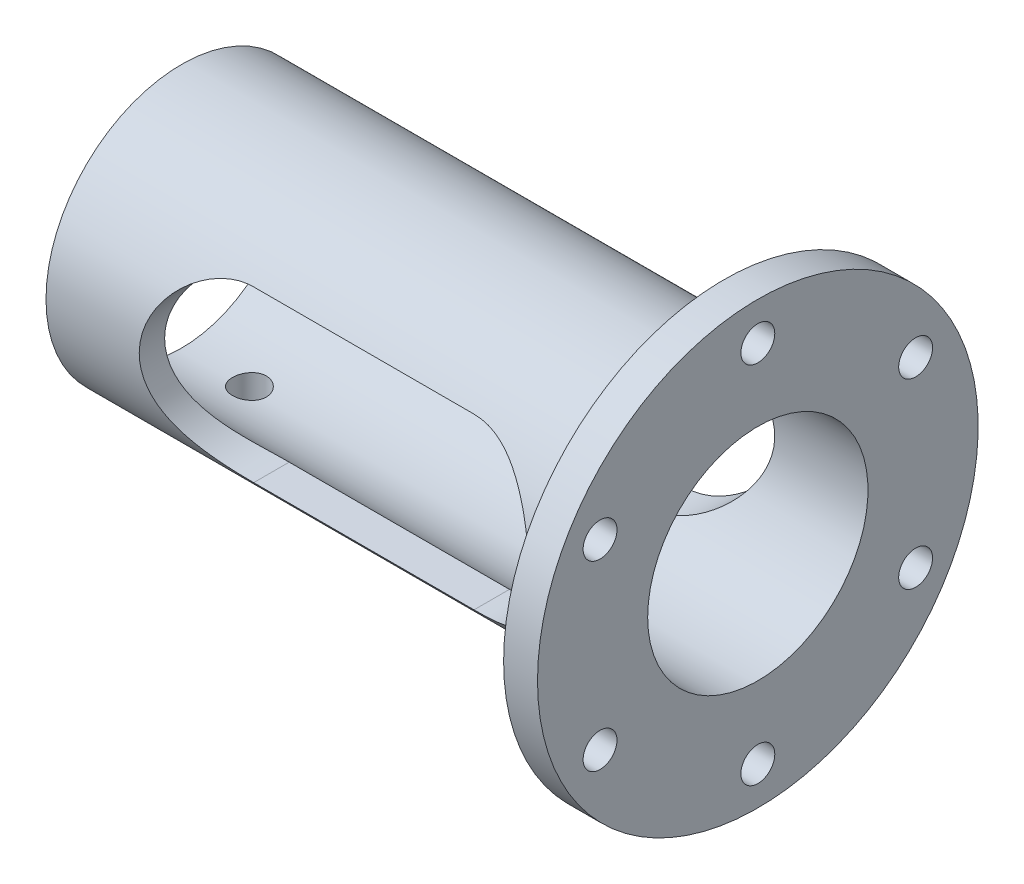
from build123d import *

# Parameters (mm, degrees)
SKETCH2_R               = 2
CUT_EXTRUDE1_DEPTH      = 78.30459236
CUT_EXTRUDE2_DEPTH      = 51.079936102
CUT_EXTRUDE2_DEPTH_BACK = 51.079936102
CUT_EXTRUDE3_DEPTH      = 1
CUT_EXTRUDE3_DEPTH_BACK = 51.07993617
SKETCH5_R               = 2


with BuildPart() as part:
    # Sketch1 → Revolve1 (revolve)
    with BuildSketch(Plane.XY, mode=Mode.PRIVATE) as revolve1_sk:
        Polygon((-34, 13), (-34, 16), (30, 16), (30, 26), (34, 26), (34, 13), align=None)
    revolve(revolve1_sk.sketch.rotate(Axis((-47.04950495, 0, 0), (1, 0, 0)), 90), axis=Axis((-47.04950495, 0, 0), (1, 0, 0)))

    # Sketch2 → Cut-Extrude1 (cut, through all)
    with BuildSketch(Plane(origin=(34, 0, 0), x_dir=(0, 0, -1), z_dir=(1, 0, 0))):
        with Locations((0, -21.5)):
            Circle(SKETCH2_R)
        with Locations((-18.619546181, -10.75)):
            Circle(SKETCH2_R)
        with Locations((-18.619546181, 10.75)):
            Circle(SKETCH2_R)
        with Locations((0, 21.5)):
            Circle(SKETCH2_R)
        with Locations((18.619546181, 10.75)):
            Circle(SKETCH2_R)
        with Locations((18.619546181, -10.75)):
            Circle(SKETCH2_R)
    extrude(amount=-CUT_EXTRUDE1_DEPTH, mode=Mode.SUBTRACT)

    # Sketch4 → Cut-Extrude2 (cut, two sides: drawn at the far end of the back side and taken through both)
    with BuildSketch(Plane.XY.offset(-CUT_EXTRUDE2_DEPTH_BACK)):
        with BuildLine():
            Line((-13, 10), (13, 10))
            ThreePointArc((13, 10), (23, 0), (13, -10))
            Line((13, -10), (-13, -10))
            ThreePointArc((-13, -10), (-23, 0), (-13, 10))
        make_face()
    extrude(amount=CUT_EXTRUDE2_DEPTH + CUT_EXTRUDE2_DEPTH_BACK, mode=Mode.SUBTRACT)

    # Sketch5 → Cut-Extrude3 (cut, two sides: drawn at the far end of the back side and taken through both)
    with BuildSketch(Plane(origin=(0, 0, 0), x_dir=(1, 0, 0), z_dir=(0, 1, 0)).offset(-CUT_EXTRUDE3_DEPTH_BACK)):
        with Locations(Location((-26, 0, 0), (0, 0, 270))):
            Circle(SKETCH5_R)
        with Locations(Location((13, 0, 0), (0, 0, 270))):
            Circle(SKETCH5_R)
    extrude(amount=CUT_EXTRUDE3_DEPTH + CUT_EXTRUDE3_DEPTH_BACK, mode=Mode.SUBTRACT)


solid = part.part
